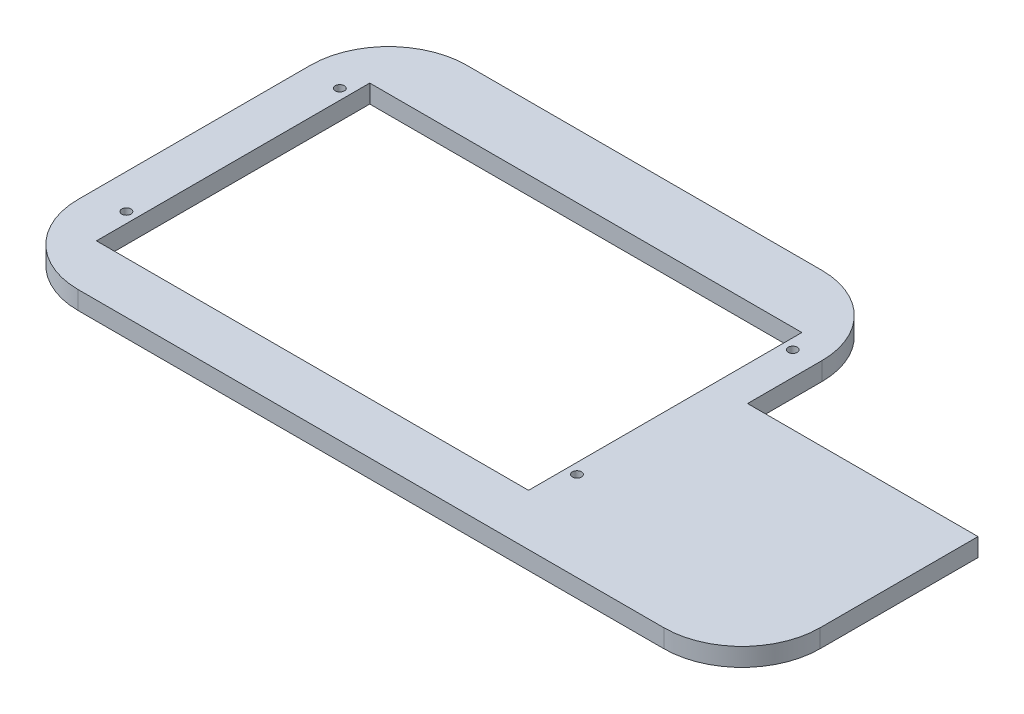
from build123d import *

# Parameters (mm, degrees)
SKETCH1_R           = 1.75
BOSS_EXTRUDE1_DEPTH = 7


with BuildPart() as part:
    # Sketch1 → Boss-Extrude1 (new body)
    with BuildSketch(Plane(origin=(0, 0, 0), x_dir=(1, 0, 0), z_dir=(0, 1, 0))):
        with BuildLine():
            Line((117.322501745, 42.275563128), (-19.177498255, 42.275563128))
            ThreePointArc((-19.177498255, 42.275563128), (-40.39070169, 33.488766564), (-49.177498255, 12.275563128))
            Line((-49.177498255, 12.275563128), (-49.177498255, -76.986202657))
            ThreePointArc((-49.177498255, -76.986202657), (-40.39070169, -98.199406092), (-19.177498255, -106.986202657))
            Line((-19.177498255, -106.986202657), (156.322501745, -106.986202657))
            Line((156.322501745, -106.986202657), (205.849333343, -106.986202657))
            ThreePointArc((205.849333343, -106.986202657), (227.062536779, -98.199406092), (235.849333343, -76.986202657))
            Line((235.849333343, -76.986202657), (235.849333343, -16.324436872))
            Line((235.849333343, -16.324436872), (147.322501745, -16.324436872))
            Line((147.322501745, -16.324436872), (147.322501745, 12.275563128))
            ThreePointArc((147.322501745, 12.275563128), (138.535705181, 33.488766564), (117.322501745, 42.275563128))
        make_face()
        with Locations(Location((-35.865896123, -71.768154209, 0), (0, 0, 270))):
            Circle(SKETCH1_R, mode=Mode.SUBTRACT)
        Polygon((-31.865896123, -87.268154209), (-31.865896123, 17.731845791), (134.134103877, 17.731845791), (134.134103877, 10.231845791), (134.139344233, -34.268153014), (134.134104035, -71.167046413), (134.134103877, -71.16815413), (134.134103877, -87.268154209), align=None, mode=Mode.SUBTRACT)
        with Locations(Location((138.134103877, -72.683111915, 0), (0, 0, 270))):
            Circle(SKETCH1_R, mode=Mode.SUBTRACT)
        with Locations(Location((-35.865896123, 10.231845791, 0), (0, 0, 270))):
            Circle(SKETCH1_R, mode=Mode.SUBTRACT)
        with Locations(Location((138.134103877, 10.231845791, 0), (0, 0, 270))):
            Circle(SKETCH1_R, mode=Mode.SUBTRACT)
    extrude(amount=BOSS_EXTRUDE1_DEPTH)


solid = part.part
